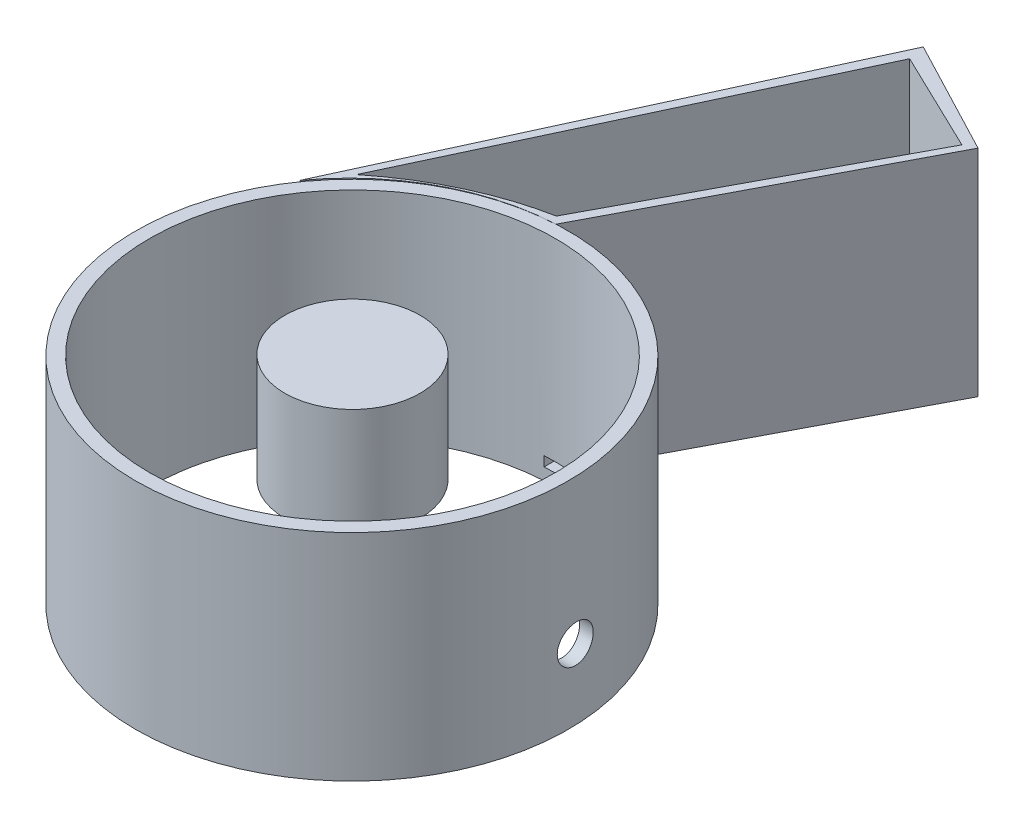
from build123d import *

# Parameters (mm, degrees)
SKETCH1_R                = 40
BOSS_EXTRUDE2_DEPTH      = 39.78932127
BOSS_EXTRUDE3_DEPTH      = 0.0001
BOSS_EXTRUDE3_DEPTH_BACK = 39.791091685
SKETCH6_R                = 37.5
CUT_EXTRUDE3_DEPTH       = 145.58565744
CUT_EXTRUDE4_DEPTH       = 145.585684961
BOSS_EXTRUDE5_DEPTH      = 40
BOSS_EXTRUDE5_DEPTH_BACK = 0.0001
SKETCH10_R               = 12.5
SKETCH11_R               = 2.75
BOSS_EXTRUDE6_DEPTH      = 4.02
BOSS_EXTRUDE6_2_DEPTH    = 4.02
BOSS_EXTRUDE6_3_DEPTH    = 4.02
BOSS_EXTRUDE6_4_DEPTH    = 4.02
BOSS_EXTRUDE6_5_DEPTH    = 4.02
BOSS_EXTRUDE6_6_DEPTH    = 4.02
SKETCH12_R               = 2.225
CUT_EXTRUDE5_DEPTH       = 144.583570712
SKETCH15_R               = 12.5
CUT_EXTRUDE6_DEPTH       = 20
SKETCH20_R               = 3.45
CUT_EXTRUDE15_DEPTH      = 34
SKETCH21_W               = 6.85
SKETCH21_H               = 1.8
CUT_EXTRUDE17_DEPTH      = 34
SKETCH12_2_R             = 2.225
CUT_EXTRUDE18_DEPTH      = 34


with BuildPart() as part:
    # Sketch1 → Boss-Extrude2 (new body)
    with BuildSketch(Plane(origin=(0, 0, 0), x_dir=(1, 0, 0), z_dir=(0, 1, 0))):
        with Locations((-62.934827524, -8.8509938)):
            Circle(SKETCH1_R)
    extrude(amount=BOSS_EXTRUDE2_DEPTH)

    # Sketch6 → Cut-Extrude3 (cut, through all)
    with BuildSketch(Plane(origin=(0, 39.78932127, 0), x_dir=(1, 0, 0), z_dir=(0, 1, 0))):
        with Locations((-62.934827524, -8.745171417)):
            Circle(SKETCH6_R)
    extrude(amount=-CUT_EXTRUDE3_DEPTH, mode=Mode.SUBTRACT)

    # Sketch20 → Cut-Extrude15 (cut)
    with BuildSketch(Plane(origin=(0, 0, 0), x_dir=(0, 0, -1), z_dir=(1, 0, 0))):
        with Locations((-7.402571606, 12.987944342)):
            Circle(SKETCH20_R)
    extrude(amount=-CUT_EXTRUDE15_DEPTH, mode=Mode.SUBTRACT)

    # Sketch21 → Cut-Extrude17 (cut)
    with BuildSketch(Plane.XY):
        with Locations((-61.529597063, 3.138215431)):
            Rectangle(SKETCH21_W, SKETCH21_H)
    extrude(amount=-CUT_EXTRUDE17_DEPTH, mode=Mode.SUBTRACT)


with BuildPart() as body_2:
    # Sketch2 → Boss-Extrude3 (new, two sides: drawn at the far end of the back side and taken through both)
    with BuildSketch(Plane(origin=(0, 39.78932127, 0), x_dir=(1, 0, 0), z_dir=(0, 1, 0)).offset(-BOSS_EXTRUDE3_DEPTH_BACK)):
        with BuildLine():
            Line((-65.165650645, 31.086750605), (-38.338403536, 82.2723051))
            Line((-38.338403536, 82.2723051), (-59.595668461, 93.413610585))
            Line((-59.595668461, 93.413610585), (-95.838477685, 14.44085743))
            ThreePointArc((-95.838477685, 14.44085743), (-82.403548817, 26.26760578), (-65.165650645, 31.086750605))
        make_face()
    extrude(amount=BOSS_EXTRUDE3_DEPTH + BOSS_EXTRUDE3_DEPTH_BACK)

    # Sketch9 → Cut-Extrude4 (cut, through all)
    with BuildSketch(Plane(origin=(0, 39.78942127, 0), x_dir=(1, 0, 0), z_dir=(0, 1, 0))):
        with BuildLine():
            Line((-58.959359155, 90.26371428), (-40.348519963, 81.302010849))
            Line((-40.348519963, 81.302010849), (-66.426872292, 32.413752837))
            add(Edge.make_bspline(
                [(-66.426872292, 32.413752837), (-75.640635654, 30.670480402), (-84.248783768, 26.427484872), (-91.543463784, 20.594922289)],
                knots=[0, 0, 0, 0, 1, 1, 1, 1], degree=3))
            Line((-91.543463784, 20.594922289), (-58.959359155, 90.26371428))
        make_face()
    extrude(amount=-CUT_EXTRUDE4_DEPTH, mode=Mode.SUBTRACT)


with BuildPart() as body_3:
    # Sketch10 → Boss-Extrude5 (new, two sides: drawn at the far end of the back side and taken through both)
    with BuildSketch(Plane(origin=(0, 0, 0), x_dir=(1, 0, 0), z_dir=(0, 1, 0)).offset(-BOSS_EXTRUDE5_DEPTH_BACK)):
        with Locations((-62.934827524, -8.744998299)):
            Circle(SKETCH10_R)
    extrude(amount=BOSS_EXTRUDE5_DEPTH + BOSS_EXTRUDE5_DEPTH_BACK)

    # Sketch15 → Cut-Extrude6 (cut)
    with BuildSketch(Plane.XZ.offset(0.0001)):
        with Locations((-62.934827524, 8.744998299)):
            Circle(SKETCH15_R)
    extrude(amount=-CUT_EXTRUDE6_DEPTH, mode=Mode.SUBTRACT)


with BuildPart() as body_4:
    # Sketch11 → Boss-Extrude6 (new body)
    with BuildSketch(Plane(origin=(0, 0, 0), x_dir=(1, 0, 0), z_dir=(0, 1, 0))):
        with Locations((-84.900677015, 18.035237824)):
            Circle(SKETCH11_R)
    extrude(amount=BOSS_EXTRUDE6_DEPTH)


with BuildPart() as body_5:
    # Sketch11 → Boss-Extrude6 2 (new body)
    with BuildSketch(Plane(origin=(0, 0, 0), x_dir=(1, 0, 0), z_dir=(0, 1, 0))):
        with Locations((-41.796072931, 18.79783428)):
            Circle(SKETCH11_R)
    extrude(amount=BOSS_EXTRUDE6_2_DEPTH)


with BuildPart() as body_6:
    # Sketch11 → Boss-Extrude6 3 (new body)
    with BuildSketch(Plane(origin=(0, 0, 0), x_dir=(1, 0, 0), z_dir=(0, 1, 0))):
        with Locations((-84.807000271, -35.712593361)):
            Circle(SKETCH11_R)
    extrude(amount=BOSS_EXTRUDE6_3_DEPTH)


with BuildPart() as body_7:
    # Sketch11 → Boss-Extrude6 4 (new body)
    with BuildSketch(Plane(origin=(0, 0, 0), x_dir=(1, 0, 0), z_dir=(0, 1, 0))):
        with Locations((-41.403931801, -35.993648692)):
            Circle(SKETCH11_R)
    extrude(amount=BOSS_EXTRUDE6_4_DEPTH)


with BuildPart() as body_8:
    # Sketch11 → Boss-Extrude6 5 (new body)
    with BuildSketch(Plane(origin=(0, 0, 0), x_dir=(1, 0, 0), z_dir=(0, 1, 0))):
        with Locations((-59.028864713, 83.523966767)):
            Circle(SKETCH11_R)
    extrude(amount=BOSS_EXTRUDE6_5_DEPTH)


with BuildPart() as body_9:
    # Sketch11 → Boss-Extrude6 6 (new body)
    with BuildSketch(Plane(origin=(0, 0, 0), x_dir=(1, 0, 0), z_dir=(0, 1, 0))):
        with Locations((-67.331101039, 36.938888632)):
            Circle(SKETCH11_R)
    extrude(amount=BOSS_EXTRUDE6_6_DEPTH)


with BuildPart() as cut_extrude5_tool:
    # Sketch12 → Cut-Extrude5 (new, through all)
    with BuildSketch(Plane(origin=(0, 4.02, 0), x_dir=(1, 0, 0), z_dir=(0, 1, 0))):
        with Locations((-84.900677015, 18.035237824)):
            Circle(SKETCH12_R)
        with Locations((-84.807000271, -35.712593361)):
            Circle(SKETCH12_R)
        with Locations((-41.796072931, 18.79783428)):
            Circle(SKETCH12_R)
        with Locations((-41.403931801, -35.993648692)):
            Circle(SKETCH12_R)
        with Locations((-67.331101039, 36.938888632)):
            Circle(SKETCH12_R)
        with Locations((-59.028864713, 83.523966767)):
            Circle(SKETCH12_R)
    extrude(amount=-CUT_EXTRUDE5_DEPTH)


with BuildPart() as body_4_1:
    add(body_4.part)

    # Cut-Extrude5: cut by cut_extrude5_tool
    add(cut_extrude5_tool.part, mode=Mode.SUBTRACT)


with BuildPart() as body_5_1:
    add(body_5.part)

    # Cut-Extrude5: cut by cut_extrude5_tool
    add(cut_extrude5_tool.part, mode=Mode.SUBTRACT)


with BuildPart() as body_6_1:
    add(body_6.part)

    # Cut-Extrude5: cut by cut_extrude5_tool
    add(cut_extrude5_tool.part, mode=Mode.SUBTRACT)


with BuildPart() as body_7_1:
    add(body_7.part)

    # Cut-Extrude5: cut by cut_extrude5_tool
    add(cut_extrude5_tool.part, mode=Mode.SUBTRACT)


with BuildPart() as cut_extrude18_tool:
    # Sketch12<2> → Cut-Extrude18 (new body)
    with BuildSketch(Plane(origin=(0, 4.02, 0), x_dir=(1, 0, 0), z_dir=(0, 1, 0))):
        with Locations((-84.900677015, 18.035237824)):
            Circle(SKETCH12_2_R)
        with Locations((-84.807000271, -35.712593361)):
            Circle(SKETCH12_2_R)
        with Locations((-41.796072931, 18.79783428)):
            Circle(SKETCH12_2_R)
        with Locations((-41.403931801, -35.993648692)):
            Circle(SKETCH12_2_R)
        with Locations((-67.331101039, 36.938888632)):
            Circle(SKETCH12_2_R)
        with Locations((-59.028864713, 83.523966767)):
            Circle(SKETCH12_2_R)
    extrude(amount=-CUT_EXTRUDE18_DEPTH)


with BuildPart() as body_8_1:
    add(body_8.part)

    # Cut-Extrude18: cut by cut_extrude18_tool
    add(cut_extrude18_tool.part, mode=Mode.SUBTRACT)


with BuildPart() as body_9_1:
    add(body_9.part)

    # Cut-Extrude18: cut by cut_extrude18_tool
    add(cut_extrude18_tool.part, mode=Mode.SUBTRACT)


solid = Compound([part.part, body_2.part, body_3.part, body_4_1.part, body_5_1.part, body_6_1.part, body_7_1.part, body_8_1.part, body_9_1.part])
